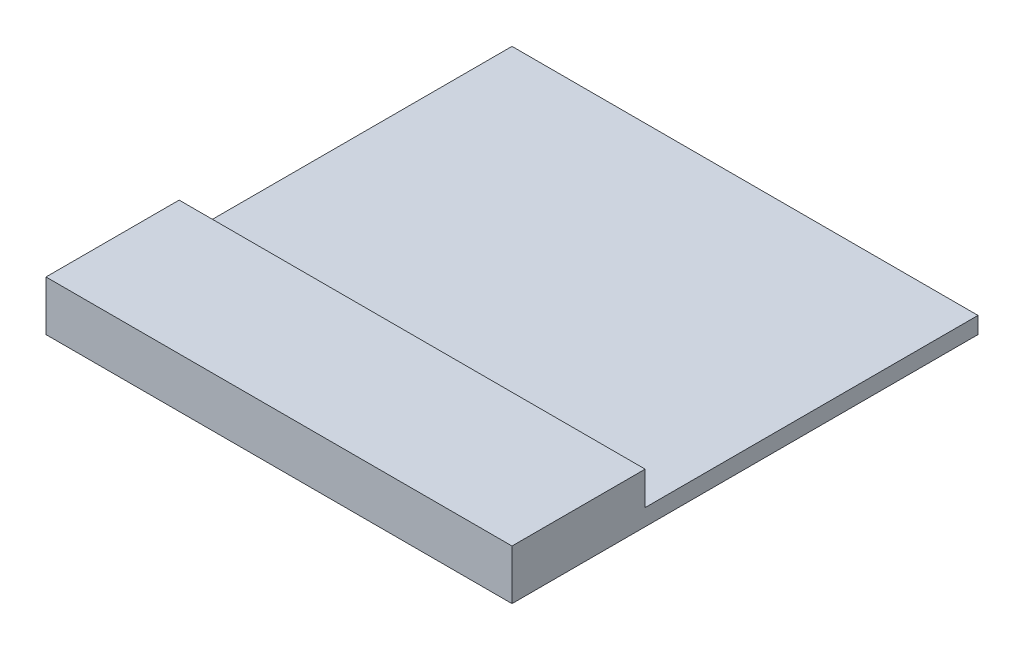
from build123d import *

# Parameters (mm, degrees)
SKETCH1_W           = 28
SKETCH1_H           = 28
BOSS_EXTRUDE1_DEPTH = 1
SKETCH2_W           = 28
SKETCH2_H           = 8
BOSS_EXTRUDE2_DEPTH = 2


with BuildPart() as part:
    # Sketch1 → Boss-Extrude1 (new body)
    with BuildSketch(Plane(origin=(0, 0, 0), x_dir=(1, 0, 0), z_dir=(0, 1, 0))):
        with Locations((14, 14)):
            Rectangle(SKETCH1_W, SKETCH1_H)
    extrude(amount=BOSS_EXTRUDE1_DEPTH)

    # Sketch2 → Boss-Extrude2 (add)
    with BuildSketch(Plane(origin=(0, 1, 0), x_dir=(1, 0, 0), z_dir=(0, 1, 0))):
        with Locations((14, 4)):
            Rectangle(SKETCH2_W, SKETCH2_H)
    extrude(amount=BOSS_EXTRUDE2_DEPTH)


solid = part.part
